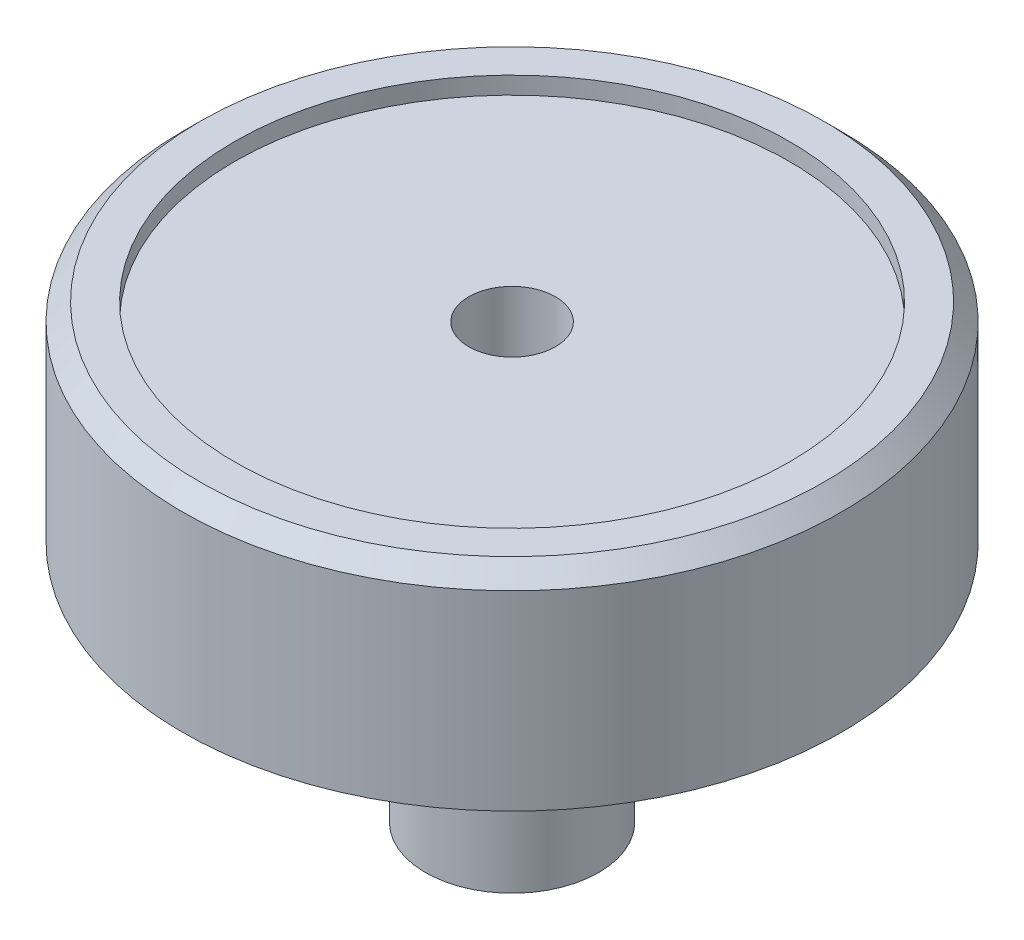
from build123d import *

# Parameters (mm, degrees)
CHAMFER_1_SIZE         = 0.5
EXTRUDE_1649_DEPTH     = 5.5
SKETCH_6_R             = 8
CUT_EXTRUDE_1797_DEPTH = 0.5
SKETCH_9_R             = 2.5
EXTRUDE_1978_DEPTH     = 3
HOLE_WIZARD_M2_5_D     = 2.5


with BuildPart() as part:
    # Эскиз2 → Revolve 1260 (revolve)
    with BuildSketch(Plane.XY):
        Polygon((0, 4.5), (-9.5, 4.5), (-9.5, -1.5), (-6, -1.5), (-6, 0), (0, 0), align=None)
    revolve(axis=Axis((0, 4.5, 0), (0, -1, 0)))

    # Фаска1
    chamfer_1_edges = [part.edges().sort_by_distance(p)[0] for p in [
        (9.5, 4.5, 0),
    ]]
    chamfer(chamfer_1_edges, length=CHAMFER_1_SIZE)

    # Эскиз8 → Extrude 1649 (add)
    with BuildSketch(Plane.XZ):
        with BuildLine():
            Line((-1.175, 3.175), (1.175, 3.175))
            ThreePointArc((1.175, 3.175), (2.589213562, 2.589213562), (3.175, 1.175))
            Line((3.175, 1.175), (3.175, -1.175))
            ThreePointArc((3.175, -1.175), (2.589213562, -2.589213562), (1.175, -3.175))
            Line((1.175, -3.175), (-1.175, -3.175))
            ThreePointArc((-1.175, -3.175), (-2.589213562, -2.589213562), (-3.175, -1.175))
            Line((-3.175, -1.175), (-3.175, 1.175))
            ThreePointArc((-3.175, 1.175), (-2.589213562, 2.589213562), (-1.175, 3.175))
        make_face()
    extrude(amount=EXTRUDE_1649_DEPTH)

    # Эскиз6 → Cut-Extrude 1797 (cut)
    with BuildSketch(Plane(origin=(0, 4.5, 0), x_dir=(1, 0, 0), z_dir=(0, 1, 0))):
        with Locations(Location((0, 0, 0), (0, 0, 180))):
            Circle(SKETCH_6_R)
    extrude(amount=-CUT_EXTRUDE_1797_DEPTH, mode=Mode.SUBTRACT)

    # Эскиз9 → Extrude 1978 (add)
    with BuildSketch(Plane.XZ.offset(5.5)):
        Circle(SKETCH_9_R)
    extrude(amount=EXTRUDE_1978_DEPTH)

    # Отверстие M2,5 (through all)
    with Locations(Plane(origin=(0, -8.5, 0), x_dir=(-1, 0, 0), z_dir=(0, -1, 0))):
        with Locations((0, 0)):
            Hole(HOLE_WIZARD_M2_5_D / 2)


solid = part.part
